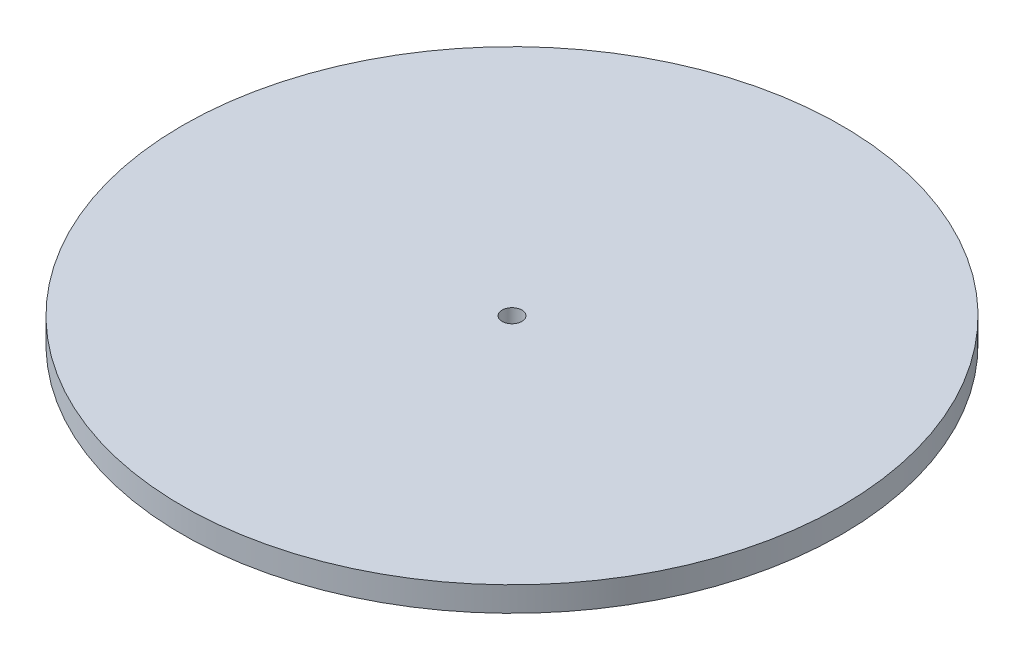
from build123d import *

# Parameters (mm, degrees)
SKETCH5_R          = 1.2
CUT_EXTRUDE1_DEPTH = 58.199915582


with BuildPart() as part:
    # Sketch3 → Revolve4 (revolve)
    with BuildSketch(Plane.XY, mode=Mode.PRIVATE) as revolve4_sk:
        with BuildLine():
            Line((1.2, 8.475278217), (1.2, 3.475278217))
            Line((1.2, 3.475278217), (0, 3.475278217))
            Line((0, 3.475278217), (0, 0))
            add(Edge.make_bspline(
                [(0, 0), (4.625000001, 0.000222748), (9.250000002, 0.236781286), (13.875000002, 0.716081328), (18.500000002, 1.36108971), (23.125000001, 2.08108319), (27.750000001, 2.859251975), (32.375, 3.660782133), (37, 4.475278217)],
                knots=[0.083383624, 0.083383624, 0.083383624, 0.083383624, 0.083383624, 0.083383624, 0.083383624, 0.083383624, 0.083383624, 0.917219866, 0.917219866, 0.917219866, 0.917219866, 0.917219866, 0.917219866, 0.917219866, 0.917219866, 0.917219866], degree=8))
            Line((37, 4.475278217), (37, 5.475278217))
            Line((37, 5.475278217), (40, 5.475278217))
            Line((40, 5.475278217), (40, 8.475278217))
            Line((40, 8.475278217), (1.2, 8.475278217))
        make_face()
    revolve(revolve4_sk.sketch.rotate(Axis((0, 8.475278217, 0), (0, -1, 0)), 180), axis=Axis((0, 8.475278217, 0), (0, -1, 0)))

    # Sketch5 → Cut-Extrude1 (cut, through all)
    with BuildSketch(Plane(origin=(0, 8.475278217, 0), x_dir=(1, 0, 0), z_dir=(0, 1, 0))):
        with Locations(Location((0, 0, 0), (0, 0, 180))):
            Circle(SKETCH5_R)
    extrude(amount=-CUT_EXTRUDE1_DEPTH, mode=Mode.SUBTRACT)


solid = part.part
